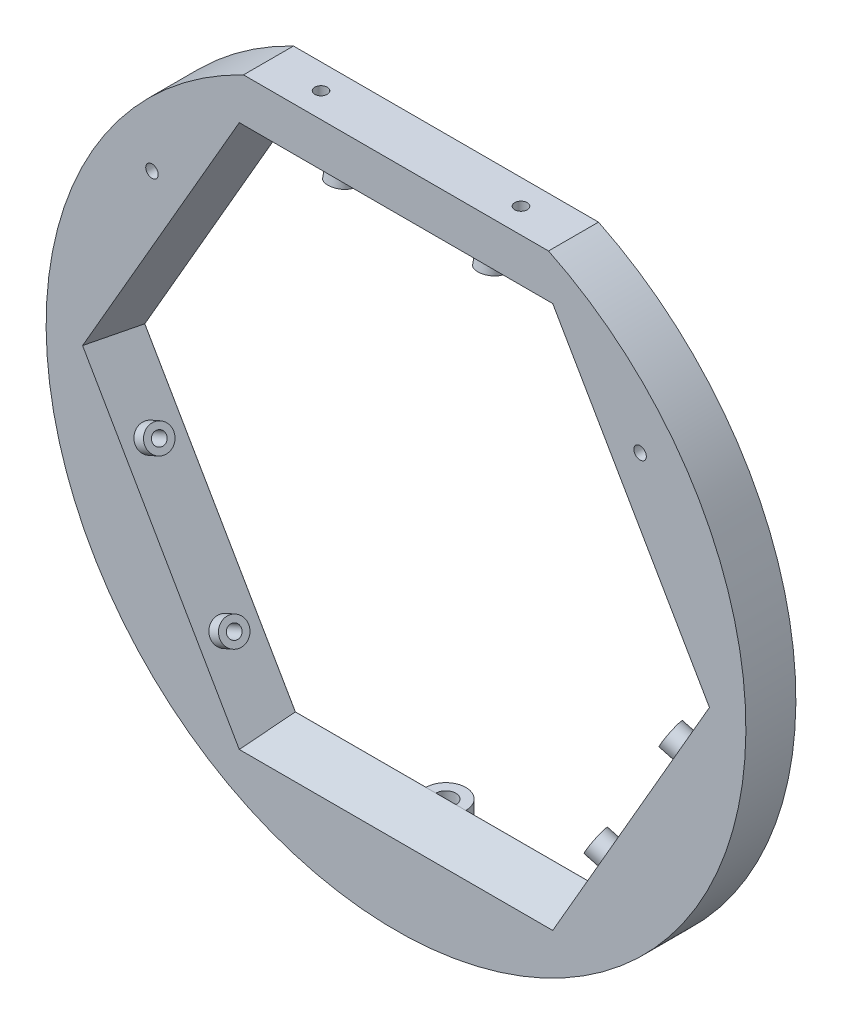
from build123d import *

# Parameters (mm, degrees)
ESQUISSE1_R                  = 70
BOSS_EXTRU_1_DEPTH           = 10
CHANFREIN1_SIZE              = 2.12
CHANFREIN1_SIZE2             = 9.973815832
ESQUISSE2_R                  = 1.25
ENL_V_MAT_EXTRU_1_DEPTH      = 8
BOSS_EXTRU_2_START           = 3
ESQUISSE3_R                  = 2.5
ESQUISSE3_R_2                = 1.25
BOSS_EXTRU_2_DEPTH           = 3
R_P_TITION_CIRCULAIRE1_COUNT = 3
ENL_V_MAT_EXTRU_2_REACH      = 101.499
ESQUISSE5_R                  = 1.25
ENL_V_MAT_EXTRU_3_DEPTH      = 8
ENL_V_MAT_EXTRU_4_REACH      = 101.499
ESQUISSE6_R                  = 1.25
BOSS_EXTRU_3_DEPTH           = 5


with BuildPart() as part:
    # Esquisse1 → Boss.-Extru.1 (new body)
    with BuildSketch(Plane.XY):
        Circle(ESQUISSE1_R)
        Polygon((60.258047595, 0), (30.129023798, 52.185), (-30.129023798, 52.185), (-60.258047595, 0), (-30.129023798, -52.185), (30.129023798, -52.185), align=None, mode=Mode.SUBTRACT)
    extrude(amount=BOSS_EXTRU_1_DEPTH)

    # Chanfrein1
    chanfrein1_edges = [part.edges().sort_by_distance(p)[0] for p in [
        (45.193535696, -26.0925, 10),
        (45.193535696, 26.0925, 10),
        (0, 52.185, 10),
        (-45.193535696, 26.0925, 10),
        (-45.193535696, -26.0925, 10),
        (0, -52.185, 10),
    ]]
    chanfrein1_side = [part.faces().sort_by_distance(p)[0] for p in [
        (-68.020101013, 0, 10),
    ]]
    chamfer(chanfrein1_edges, length=CHANFREIN1_SIZE, length2=CHANFREIN1_SIZE2, reference=chanfrein1_side[0])

    # Esquisse2 → Enlèv. mat.-Extru.1 (cut)
    with BuildSketch(Plane(origin=(-43.235330862, -24.961929912, -10.611643989), x_dir=(0.1800568059919566, 0.10395584540888045, -0.9781476007338055), z_dir=(0.8471006708862736, 0.48907380036690296, 0.20791169081776076))):
        with Locations(Location((-16.540417403, 15, 0), (0, 0, 90))):
            Circle(ESQUISSE2_R)
        with Locations(Location((-16.540417403, -15, 0), (0, 0, 90))):
            Circle(ESQUISSE2_R)
    enl_v_mat_extru_1 = extrude(amount=-ENL_V_MAT_EXTRU_1_DEPTH, mode=Mode.SUBTRACT)

    # Esquisse3 → Boss.-Extru.2 (add)
    # profile 1 of 2: a face of its own
    with BuildSketch(Plane(origin=(-43.235330862, -24.961929912, -10.611643989), x_dir=(0.1800568059919566, 0.10395584540888045, -0.9781476007338055), z_dir=(0.8471006708862736, 0.48907380036690296, 0.20791169081776076)).offset(BOSS_EXTRU_2_START)):
        with Locations(Location((-16.540417403, -15, 0), (0, 0, 90))):
            Circle(ESQUISSE3_R)
        with Locations(Location((-16.540417403, -15, 0), (0, 0, 90))):
            Circle(ESQUISSE3_R_2, mode=Mode.SUBTRACT)
    # profile 2 of 2: a face of its own
    with BuildSketch(Plane(origin=(-43.235330862, -24.961929912, -10.611643989), x_dir=(0.1800568059919566, 0.10395584540888045, -0.9781476007338055), z_dir=(0.8471006708862736, 0.48907380036690296, 0.20791169081776076)).offset(BOSS_EXTRU_2_START)):
        with Locations(Location((-16.540417403, 15, 0), (0, 0, 90))):
            Circle(ESQUISSE3_R)
        with Locations(Location((-16.540417403, 15, 0), (0, 0, 90))):
            Circle(ESQUISSE3_R_2, mode=Mode.SUBTRACT)
    boss_extru_2 = extrude(amount=-BOSS_EXTRU_2_DEPTH)

    # Répétition circulaire1: Enlèv. mat.-Extru.1, Boss.-Extru.2 ×3 about axis
    r_p_tition_circulaire1_axis = Axis((0, 0, 0), (0, 0, 1))
    add([enl_v_mat_extru_1.rotate(r_p_tition_circulaire1_axis, i * 360 / R_P_TITION_CIRCULAIRE1_COUNT) for i in range(1, R_P_TITION_CIRCULAIRE1_COUNT)], mode=Mode.SUBTRACT)
    add([boss_extru_2.rotate(r_p_tition_circulaire1_axis, i * 360 / R_P_TITION_CIRCULAIRE1_COUNT) for i in range(1, R_P_TITION_CIRCULAIRE1_COUNT)])

    # Esquisse4 → Enlèv. mat.-Extru.2 (cut, up to next)
    with BuildSketch(Plane(origin=(0, 0, 0), x_dir=(-1, 0, 0), z_dir=(0, 0, -1)), mode=Mode.PRIVATE) as enl_v_mat_extru_2_sk1:
        with BuildLine():
            Line((30.512292605, 63), (-30.512292605, 63))
            ThreePointArc((-30.512292605, 63), (0, 70), (30.512292605, 63))
        make_face()
    enl_v_mat_extru_2_tool1 = extrude(enl_v_mat_extru_2_sk1.sketch, amount=-ENL_V_MAT_EXTRU_2_REACH, mode=Mode.PRIVATE) & part.part
    add(enl_v_mat_extru_2_tool1.solids().sort_by_distance((0, 65.812358, 0))[0], mode=Mode.SUBTRACT)

    # Esquisse5 → Enlèv. mat.-Extru.3 (cut)
    with BuildSketch(Plane(origin=(0, 63, 0), x_dir=(1, 0, 0), z_dir=(0, 1, 0))):
        with Locations(Location((-20, -5, 0), (0, 0, 270))):
            Circle(ESQUISSE5_R)
        with Locations(Location((20, -5, 0), (0, 0, 270))):
            Circle(ESQUISSE5_R)
    extrude(amount=-ENL_V_MAT_EXTRU_3_DEPTH, mode=Mode.SUBTRACT)

    # Esquisse6 → Enlèv. mat.-Extru.4 (cut, up to next)
    with BuildSketch(Plane(origin=(0, 0, 0), x_dir=(-1, 0, 0), z_dir=(0, 0, -1)), mode=Mode.PRIVATE) as enl_v_mat_extru_4_sk1:
        with Locations((48.823972226, 37.179434383)):
            Circle(ESQUISSE6_R)
    enl_v_mat_extru_4_tool1 = extrude(enl_v_mat_extru_4_sk1.sketch, amount=-ENL_V_MAT_EXTRU_4_REACH, mode=Mode.PRIVATE) & part.part
    # Esquisse6 → Enlèv. mat.-Extru.4 (cut, up to next)
    with BuildSketch(Plane(origin=(0, 0, 0), x_dir=(-1, 0, 0), z_dir=(0, 0, -1)), mode=Mode.PRIVATE) as enl_v_mat_extru_4_sk2:
        with Locations((-48.823972226, 37.179434383)):
            Circle(ESQUISSE6_R)
    enl_v_mat_extru_4_tool2 = extrude(enl_v_mat_extru_4_sk2.sketch, amount=-ENL_V_MAT_EXTRU_4_REACH, mode=Mode.PRIVATE) & part.part
    add(enl_v_mat_extru_4_tool1.solids().sort_by_distance((-48.823972, 37.179434, 0))[0], mode=Mode.SUBTRACT)
    add(enl_v_mat_extru_4_tool2.solids().sort_by_distance((48.823972, 37.179434, 0))[0], mode=Mode.SUBTRACT)

    # Esquisse7 → Boss.-Extru.3 (add)
    with BuildSketch(Plane(origin=(0, -52.185, 0), x_dir=(1, 0, 0), z_dir=(0, 1, 0))):
        with BuildLine():
            Line((2, -0.026184168), (4, -0.026184168))
            ThreePointArc((4, -0.026184168), (0, 3.973815832), (-4, -0.026184168))
            Line((-4, -0.026184168), (-2, -0.026184168))
            ThreePointArc((-2, -0.026184168), (0, 1.973815832), (2, -0.026184168))
        make_face()
    extrude(amount=-BOSS_EXTRU_3_DEPTH)


solid = part.part
